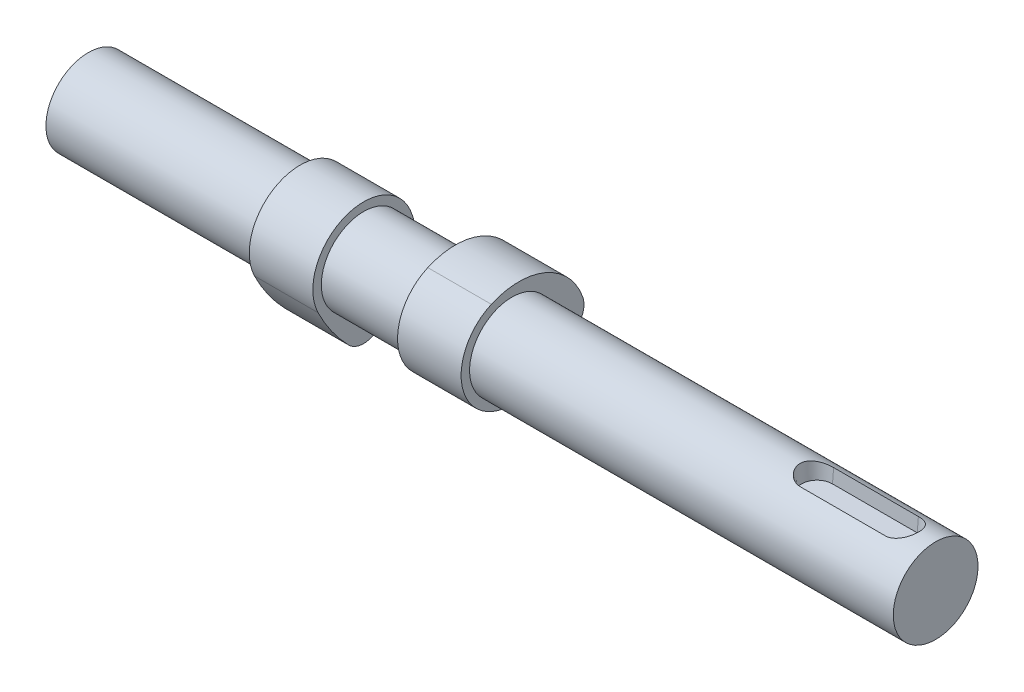
from build123d import *

# Parameters (mm, degrees)
BOSS_EXTRUDE1_DEPTH      = 125
BOSS_EXTRUDE1_DEPTH_BACK = 75
SKETCH1_R                = 10
BOSS_EXTRUDE2_START      = 10
BOSS_EXTRUDE2_DEPTH      = 15
BODY_MOVE_COPY1_ANGLE    = 90
CUT_EXTRUDE1_START       = 10
CUT_EXTRUDE1_DEPTH       = 4
CUT_EXTRUDE1_DRAFT       = -5


with BuildPart() as part:
    # Sketch1 → Boss-Extrude1 (new, two sides: drawn at the far end of the back side and taken through both)
    with BuildSketch(Plane(origin=(0, 0, 0), x_dir=(0, 0, -1), z_dir=(1, 0, 0)).offset(-BOSS_EXTRUDE1_DEPTH_BACK)):
        Circle(SKETCH1_R)
    extrude(amount=BOSS_EXTRUDE1_DEPTH + BOSS_EXTRUDE1_DEPTH_BACK)


with BuildPart() as body_2:
    # Sketch2 → Boss-Extrude2 (new body)
    with BuildSketch(Plane(origin=(0, 0, 0), x_dir=(0, 0, -1), z_dir=(1, 0, 0)).offset(BOSS_EXTRUDE2_START)):
        with BuildLine():
            ThreePointArc((-4.867089568, 10.968657125), (-10.868088345, -5.087696504), (5.306226617, -10.763083159))
            ThreePointArc((5.306226617, -10.763083159), (10.673744978, -7.573594418), (15.479542802, -3.587694386))
            ThreePointArc((15.479542802, -3.587694386), (16.864464688, -1.143374761), (16.712672037, 1.661917746))
            ThreePointArc((16.712672037, 1.661917746), (7.958571112, 11.035699457), (-4.867089568, 10.968657125))
        make_face()
    extrude(amount=BOSS_EXTRUDE2_DEPTH)


with BuildPart() as body_3:
    # Mirror1: mirrored copy
    add(body_2.part.mirror(Plane(origin=(0, 0, 0), x_dir=(0, 0, 1), z_dir=(1, 0, 0))))


with BuildPart() as body_3_1:
    # Body-Move/Copy1: moved
    add(body_3.part.rotate(Axis((0, 0, 0), (-1, 0, 0)), BODY_MOVE_COPY1_ANGLE))


with BuildPart() as cut_extrude1_tool:
    # Sketch3 → Cut-Extrude1 (with draft: the straight prism first)
    with BuildSketch(Plane(origin=(0, 0, 0), x_dir=(1, 0, 0), z_dir=(0, 1, 0)).offset(CUT_EXTRUDE1_START)):
        with BuildLine():
            ThreePointArc((97, 4), (93, 0), (97, -4))
            Line((97, -4), (117, -4))
            ThreePointArc((117, -4), (121, 0), (117, 4))
            Line((117, 4), (97, 4))
        make_face()
    extrude(amount=-CUT_EXTRUDE1_DEPTH)
    # Cut-Extrude1: the draft: its side faces are tilted about the plane it starts from
    cut_extrude1_sides = [cut_extrude1_tool.faces().sort_by_distance(p)[0] for p in [
        (107, 8, 4),
        (121, 8, 0),
        (107, 8, -4),
        (93, 8, 0),
    ]]
    draft(cut_extrude1_sides, Plane(origin=(0, 0, 0), x_dir=(1, 0, 0), z_dir=(0, 1, 0)).offset(CUT_EXTRUDE1_START), CUT_EXTRUDE1_DRAFT)


with BuildPart() as part_1:
    add(part.part)

    # Cut-Extrude1: cut by cut_extrude1_tool
    add(cut_extrude1_tool.part, mode=Mode.SUBTRACT)


solid = Compound([body_2.part, body_3_1.part, part_1.part])
